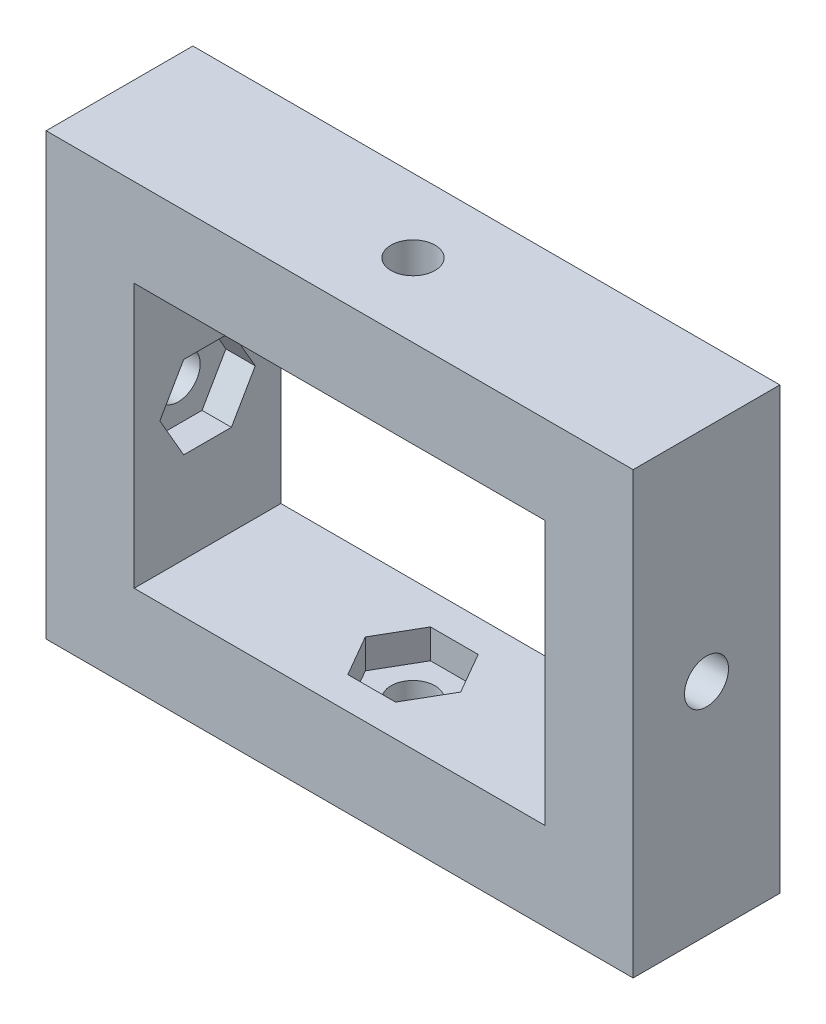
from build123d import *

# Parameters (mm, degrees)
SKETCH1_W                    = 40
SKETCH1_H                    = 30
BOSS_EXTRUDE1_DEPTH          = 10
SKETCH2_W                    = 28
SKETCH2_H                    = 18
CUT_EXTRUDE1_DEPTH           = 43.801869118
CUT_EXTRUDE2_DEPTH           = 2
CUT_EXTRUDE3_DEPTH           = 2
CUT_EXTRUDE4_DEPTH           = 2
CUT_EXTRUDE5_DEPTH           = 2
F_3_0_3_DIAMETER_HOLE1_D     = 3
F_3_0_3_DIAMETER_HOLE1_DEPTH = 4
F_3_0_3_DIAMETER_HOLE2_D     = 3
F_3_0_3_DIAMETER_HOLE2_DEPTH = 4
F_3_0_3_DIAMETER_HOLE3_D     = 3
F_3_0_3_DIAMETER_HOLE4_D     = 3


with BuildPart() as part:
    # Sketch1 → Boss-Extrude1 (new body)
    with BuildSketch(Plane(origin=(0, 0, 0), x_dir=(-1, 0, 0), z_dir=(0, 0, -1))):
        with Locations((-14, 9)):
            Rectangle(SKETCH1_W, SKETCH1_H)
    extrude(amount=-BOSS_EXTRUDE1_DEPTH)

    # Sketch2 → Cut-Extrude1 (cut, through all)
    with BuildSketch(Plane.XY.offset(10)):
        with Locations((14, 9)):
            Rectangle(SKETCH2_W, SKETCH2_H)
    extrude(amount=-CUT_EXTRUDE1_DEPTH, mode=Mode.SUBTRACT)

    # Sketch3 → Cut-Extrude2 (cut)
    with BuildSketch(Plane(origin=(0, 0, 0), x_dir=(0, 0, -1), z_dir=(1, 0, 0))):
        Polygon((-8.25, 9), (-6.625, 6.185417438), (-3.375, 6.185417438), (-1.75, 9), (-3.375, 11.814582562), (-6.625, 11.814582562), align=None)
    extrude(amount=-CUT_EXTRUDE2_DEPTH, mode=Mode.SUBTRACT)

    # Sketch4 → Cut-Extrude3 (cut)
    with BuildSketch(Plane.XZ.offset(-18)):
        Polygon((17.25, 5), (15.625, 7.814582562), (12.375, 7.814582562), (10.75, 5), (12.375, 2.185417438), (15.625, 2.185417438), align=None)
    extrude(amount=-CUT_EXTRUDE3_DEPTH, mode=Mode.SUBTRACT)

    # Sketch5 → Cut-Extrude4 (cut)
    with BuildSketch(Plane.ZY.offset(-28)):
        Polygon((1.75, 9), (3.375, 6.185417438), (6.625, 6.185417438), (8.25, 9), (6.625, 11.814582562), (3.375, 11.814582562), align=None)
    extrude(amount=-CUT_EXTRUDE4_DEPTH, mode=Mode.SUBTRACT)

    # Sketch6 → Cut-Extrude5 (cut)
    with BuildSketch(Plane(origin=(0, 0, 0), x_dir=(-1, 0, 0), z_dir=(0, 1, 0))):
        Polygon((-17.25, 5), (-15.625, 2.185417438), (-12.375, 2.185417438), (-10.75, 5), (-12.375, 7.814582562), (-15.625, 7.814582562), align=None)
    extrude(amount=-CUT_EXTRUDE5_DEPTH, mode=Mode.SUBTRACT)

    # Ø3.0 (3) Diameter Hole1
    with Locations(Plane(origin=(-2, 0, 0), x_dir=(0, 0, -1), z_dir=(1, 0, 0))):
        with Locations((-5, 9)):
            Hole(F_3_0_3_DIAMETER_HOLE1_D / 2, depth=F_3_0_3_DIAMETER_HOLE1_DEPTH)

    # Ø3.0 (3) Diameter Hole2
    with Locations(Plane(origin=(0, 20, 0), x_dir=(-1, 0, 0), z_dir=(0, -1, 0))):
        with Locations((-14, -5)):
            Hole(F_3_0_3_DIAMETER_HOLE2_D / 2, depth=F_3_0_3_DIAMETER_HOLE2_DEPTH)

    # Ø3.0 (3) Diameter Hole3 (through all)
    with Locations(Plane.ZY.offset(-30)):
        with Locations((5, 9)):
            Hole(F_3_0_3_DIAMETER_HOLE3_D / 2)

    # Ø3.0 (3) Diameter Hole4 (through all)
    with Locations(Plane(origin=(0, -2, 0), x_dir=(1, 0, 0), z_dir=(0, 1, 0))):
        with Locations((14, -5)):
            Hole(F_3_0_3_DIAMETER_HOLE4_D / 2)


solid = part.part
